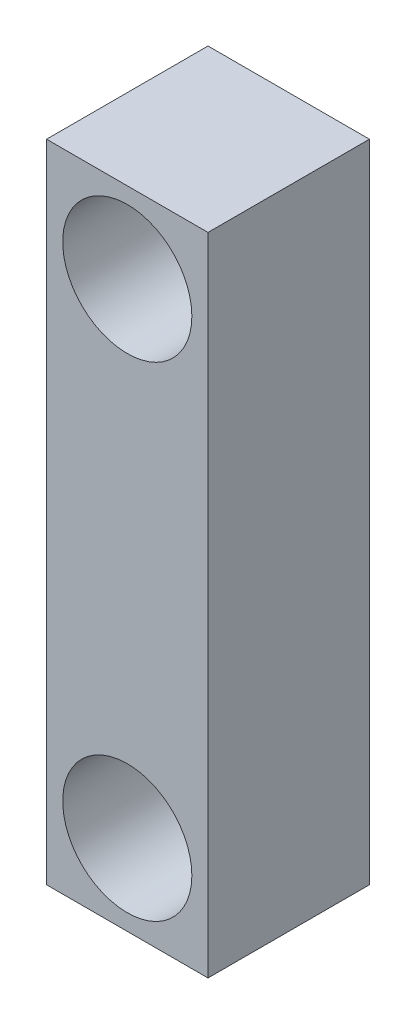
from build123d import *

# Parameters (mm, degrees)
SKETCH1_W           = 25.4
SKETCH1_H           = 101.6
BOSS_EXTRUDE1_DEPTH = 25.4
SKETCH2_R           = 10.16
CUT_EXTRUDE1_DEPTH  = 25.4
SCALE1_SCALE        = 3


with BuildPart() as part:
    # Sketch1 → Boss-Extrude1 (new body)
    with BuildSketch(Plane.XY):
        Rectangle(SKETCH1_W, SKETCH1_H)
    extrude(amount=BOSS_EXTRUDE1_DEPTH)

    # Sketch2 → Cut-Extrude1 (cut)
    with BuildSketch(Plane.XY.offset(25.4)):
        with Locations((0, -38.1)):
            Circle(SKETCH2_R)
        with Locations((0, 38.1)):
            Circle(SKETCH2_R)
    extrude(amount=-CUT_EXTRUDE1_DEPTH, mode=Mode.SUBTRACT)


with BuildPart() as part_1:
    # Scale1: scaled about (0, 0, 12.7)
    add(part.part.scale(SCALE1_SCALE).moved(Location((0, 0, -25.4))))


solid = part_1.part
